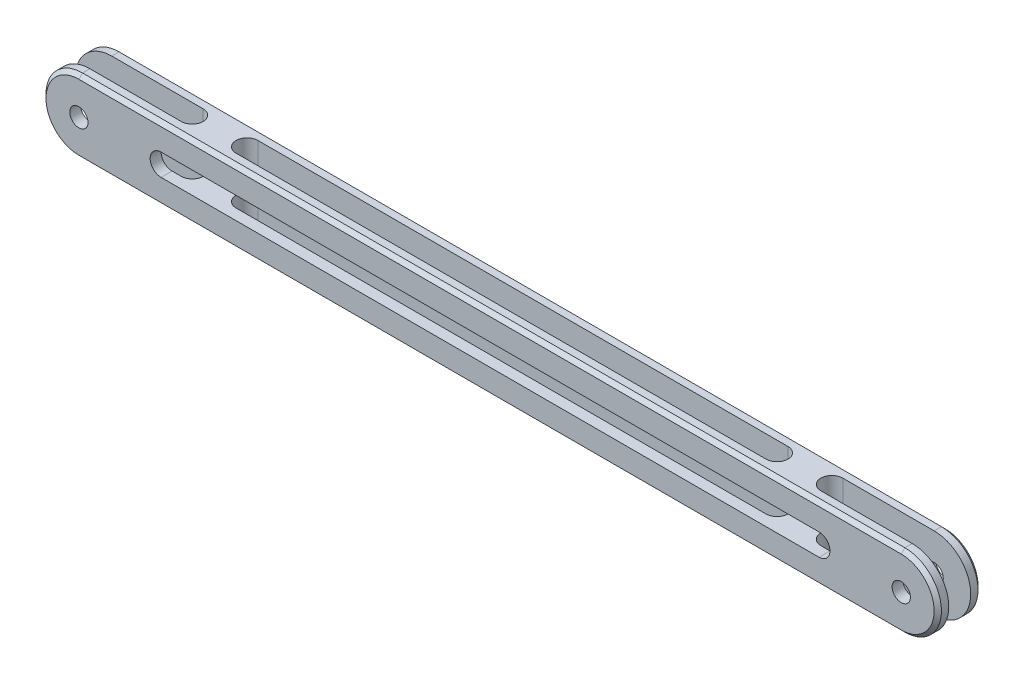
from build123d import *

# Parameters (mm, degrees)
BOSS_EXTRUDE1_DEPTH = 6
CUT_EXTRUDE1_DEPTH  = 51
SKETCH4_R           = 2.5
CUT_EXTRUDE2_DEPTH  = 102
CHAMFER1_SIZE       = 1


with BuildPart() as part:
    # Sketch2 → Boss-Extrude1 (new, symmetric)
    with BuildSketch(Plane.XY):
        with BuildLine():
            Line((-112.5, 10), (112.5, 10))
            ThreePointArc((112.5, 10), (122.5, 0), (112.5, -10))
            Line((112.5, -10), (-112.5, -10))
            ThreePointArc((-112.5, -10), (-122.5, 0), (-112.5, 10))
        make_face()
    extrude(amount=BOSS_EXTRUDE1_DEPTH, both=True)

    # Sketch3 → Cut-Extrude1 (cut, symmetric)
    with BuildSketch(Plane(origin=(0, 0, 0), x_dir=(1, 0, 0), z_dir=(0, 1, 0))):
        with BuildLine():
            Line((-72.5, 3), (72.5, 3))
            ThreePointArc((72.5, 3), (75.5, 0), (72.5, -3))
            Line((72.5, -3), (-72.5, -3))
            ThreePointArc((-72.5, -3), (-75.5, 0), (-72.5, 3))
        make_face()
        with BuildLine():
            Line((157.5, -3), (87.5, -3))
            ThreePointArc((87.5, -3), (84.5, 0), (87.5, 3))
            Line((87.5, 3), (157.5, 3))
            ThreePointArc((157.5, 3), (160.5, 0), (157.5, -3))
        make_face()
        with BuildLine():
            Line((-157.5, -3), (-87.5, -3))
            ThreePointArc((-87.5, -3), (-84.5, 0), (-87.5, 3))
            Line((-87.5, 3), (-157.5, 3))
            ThreePointArc((-157.5, 3), (-160.5, 0), (-157.5, -3))
        make_face()
    extrude(amount=CUT_EXTRUDE1_DEPTH, both=True, mode=Mode.SUBTRACT)

    # Sketch4 → Cut-Extrude2 (cut)
    with BuildSketch(Plane.XY.offset(6)):
        with Locations((112.5, 0)):
            Circle(SKETCH4_R)
        with Locations((-112.5, 0)):
            Circle(SKETCH4_R)
        with BuildLine():
            Line((-90, 3), (90, 3))
            ThreePointArc((90, 3), (93, 0), (90, -3))
            Line((90, -3), (-90, -3))
            ThreePointArc((-90, -3), (-93, 0), (-90, 3))
        make_face()
    extrude(amount=-CUT_EXTRUDE2_DEPTH, mode=Mode.SUBTRACT)

    # Chamfer1
    chamfer1_edges = [part.edges().sort_by_distance(p)[0] for p in [
        (122.5, 0, -6),
        (0, 10, -6),
        (-122.5, 0, -6),
        (0, 10, 6),
        (122.5, 0, 6),
        (0, -10, 6),
        (-122.5, 0, 6),
        (0, -10, -6),
    ]]
    chamfer(chamfer1_edges, length=CHAMFER1_SIZE)


solid = part.part
